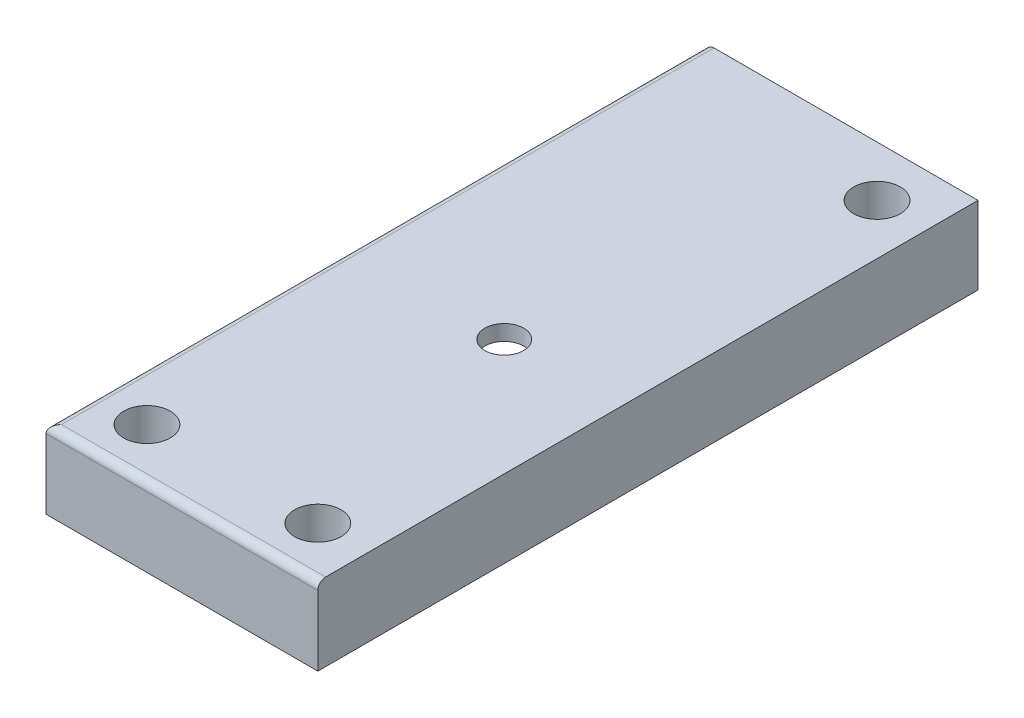
from build123d import *

# Parameters (mm, degrees)
SKETCH1_W           = 35
SKETCH1_H           = 85
BOSS_EXTRUDE1_DEPTH = 10
SKETCH2_W           = 31
SKETCH2_H           = 81
CUT_EXTRUDE1_DEPTH  = 8
SKETCH3_W           = 9
SKETCH3_H           = 9
SKETCH3_R           = 1.25
BOSS_EXTRUDE2_DEPTH = 8
CUT_EXTRUDE3_START  = -10
SKETCH4_R           = 1.25
CUT_EXTRUDE3_DEPTH  = 10
SKETCH5_R           = 3
CUT_EXTRUDE4_DEPTH  = 5
FILLET1_R           = 1
SKETCH6_R           = 2.5
CUT_EXTRUDE5_DEPTH  = 5


with BuildPart() as part:
    # Sketch1 → Boss-Extrude1 (new body)
    with BuildSketch(Plane(origin=(0, 0, 0), x_dir=(1, 0, 0), z_dir=(0, 1, 0))):
        Rectangle(SKETCH1_W, SKETCH1_H)
    extrude(amount=BOSS_EXTRUDE1_DEPTH)

    # Sketch2 → Cut-Extrude1 (cut)
    with BuildSketch(Plane.XZ):
        Rectangle(SKETCH2_W, SKETCH2_H)
    extrude(amount=-CUT_EXTRUDE1_DEPTH, mode=Mode.SUBTRACT)

    # Sketch3 → Boss-Extrude2 (add)
    # profile 1 of 3: a face of its own
    with BuildSketch(Plane.XZ.offset(-8)):
        with Locations((-11, 36)):
            Rectangle(SKETCH3_W, SKETCH3_H)
        with Locations(Location((-11, 36, 0), (0, 0, 270))):
            Circle(SKETCH3_R, mode=Mode.SUBTRACT)
    # profile 2 of 3: a face of its own
    with BuildSketch(Plane.XZ.offset(-8)):
        with Locations((11, 36)):
            Rectangle(SKETCH3_W, SKETCH3_H)
        with Locations(Location((11, 36, 0), (0, 0, 270))):
            Circle(SKETCH3_R, mode=Mode.SUBTRACT)
    # profile 3 of 3: a face of its own
    with BuildSketch(Plane.XZ.offset(-8)):
        with Locations((11, -36)):
            Rectangle(SKETCH3_W, SKETCH3_H)
        with Locations(Location((11, -36, 0), (0, 0, 270))):
            Circle(SKETCH3_R, mode=Mode.SUBTRACT)
    extrude(amount=BOSS_EXTRUDE2_DEPTH)

    # Sketch4 → Cut-Extrude3 (cut)
    with BuildSketch(Plane.XZ.offset(CUT_EXTRUDE3_START)):
        with Locations(Location((-11, 36, 0), (0, 0, 270))):
            Circle(SKETCH4_R)
        with Locations(Location((11, 36, 0), (0, 0, 270))):
            Circle(SKETCH4_R)
        with Locations(Location((11, -36, 0), (0, 0, 270))):
            Circle(SKETCH4_R)
    extrude(amount=CUT_EXTRUDE3_DEPTH, mode=Mode.SUBTRACT)

    # Sketch5 → Cut-Extrude4 (cut)
    with BuildSketch(Plane(origin=(0, 10, 0), x_dir=(1, 0, 0), z_dir=(0, 1, 0))):
        with Locations(Location((11, -36, 0), (0, 0, 270))):
            Circle(SKETCH5_R)
        with Locations(Location((-11, -36, 0), (0, 0, 270))):
            Circle(SKETCH5_R)
        with Locations(Location((11, 36, 0), (0, 0, 270))):
            Circle(SKETCH5_R)
    extrude(amount=-CUT_EXTRUDE4_DEPTH, mode=Mode.SUBTRACT)

    # Fillet1
    fillet1_edges = [part.edges().sort_by_distance(p)[0] for p in [
        (-17.5, 10, 0),
        (0, 10, 42.5),
    ]]
    fillet(fillet1_edges, radius=FILLET1_R)

    # Sketch6 → Cut-Extrude5 (cut)
    with BuildSketch(Plane(origin=(0, 10, 0), x_dir=(1, 0, 0), z_dir=(0, 1, 0))):
        with Locations(Location((2.5, -3.5, 0), (0, 0, 270))):
            Circle(SKETCH6_R)
    extrude(amount=-CUT_EXTRUDE5_DEPTH, mode=Mode.SUBTRACT)


solid = part.part
